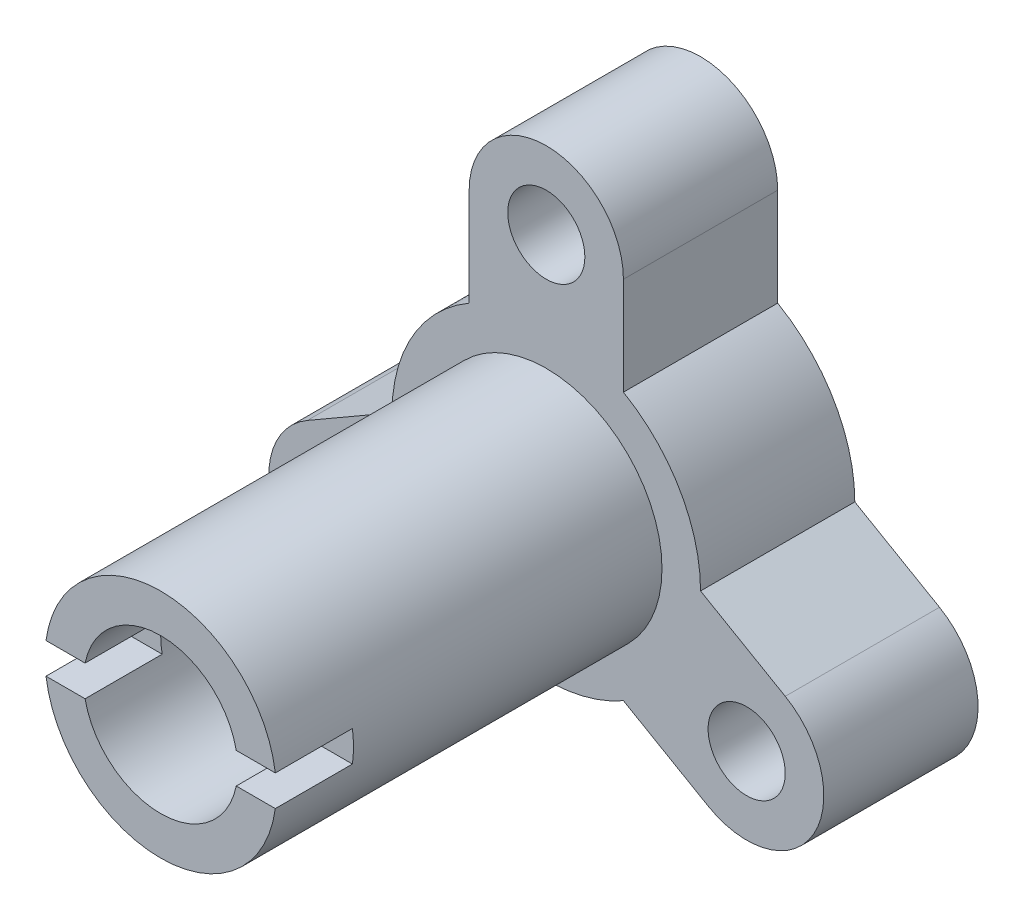
from build123d import *

# Parameters (mm, degrees)
SKETCH_1_R          = 5
EXTRUDE_1_DEPTH     = 20
SKETCH_2_R          = 15
SKETCH_2_R_2        = 10
EXTRUDE_2_DEPTH     = 50
SKETCH_3_W          = 53.583106362
SKETCH_3_H          = 4
CUT_EXTRUDE_1_DEPTH = 10


with BuildPart() as part:
    # 草圖1 → 填料-伸長1 (new body)
    with BuildSketch(Plane.XY):
        with BuildLine():
            ThreePointArc((-30.980762114, -6.339745962), (-34.641016151, -20), (-20.980762114, -23.660254038))
            Line((-20.980762114, -23.660254038), (-10, -17.320508076))
            ThreePointArc((-10, -17.320508076), (0, -20), (10, -17.320508076))
            Line((10, -17.320508076), (20.980762114, -23.660254038))
            ThreePointArc((20.980762114, -23.660254038), (34.641016151, -20), (30.980762114, -6.339745962))
            Line((30.980762114, -6.339745962), (20, 0))
            ThreePointArc((20, 0), (17.320508076, 10), (10, 17.320508076))
            Line((10, 17.320508076), (10, 30))
            ThreePointArc((10, 30), (0, 40), (-10, 30))
            Line((-10, 30), (-10, 17.320508076))
            ThreePointArc((-10, 17.320508076), (-17.320508076, 10), (-20, 0))
            Line((-20, 0), (-30.980762114, -6.339745962))
        make_face()
        with Locations((-25.980762114, -15)):
            Circle(SKETCH_1_R, mode=Mode.SUBTRACT)
        with Locations((25.980762114, -15)):
            Circle(SKETCH_1_R, mode=Mode.SUBTRACT)
        with Locations((0, 30)):
            Circle(SKETCH_1_R, mode=Mode.SUBTRACT)
    extrude(amount=EXTRUDE_1_DEPTH)

    # 草圖2 → 填料-伸長2 (add)
    with BuildSketch(Plane.XY.offset(20)):
        Circle(SKETCH_2_R)
        Circle(SKETCH_2_R_2, mode=Mode.SUBTRACT)
    extrude(amount=EXTRUDE_2_DEPTH)

    # 草圖3 → 除料-伸長1 (cut)
    with BuildSketch(Plane.XY.offset(70)):
        Rectangle(SKETCH_3_W, SKETCH_3_H)
    extrude(amount=-CUT_EXTRUDE_1_DEPTH, mode=Mode.SUBTRACT)


solid = part.part
